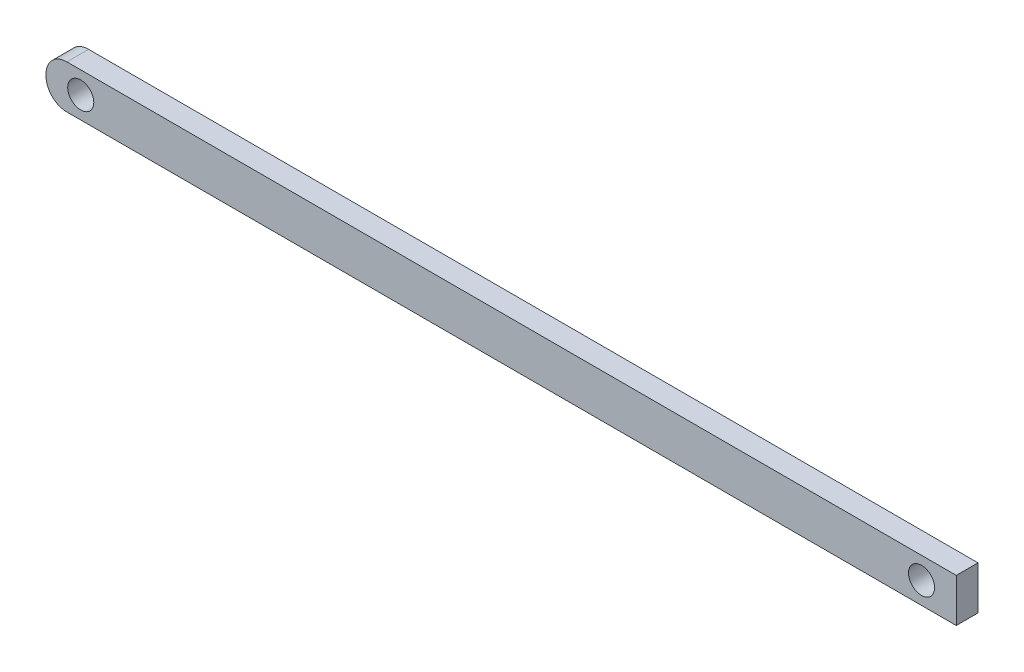
from build123d import *

# Parameters (mm, degrees)
SKETCH1_R               = 7.5
BOSS_EXTRUDE2_DEPTH     = 25
CUT_EXTRUDE1_DEPTH      = 525.744938041
CUT_EXTRUDE1_DEPTH_BACK = 525.744938041
SKETCH2_W               = 12.5
SKETCH2_H               = 25


with BuildPart() as part:
    # Sketch1 → Boss-Extrude2 (new body)
    with BuildSketch(Plane.XY):
        with BuildLine():
            Line((-250, 12.5), (262, 12.5))
            Line((262, 12.5), (262, -12.5))
            Line((262, -12.5), (-250, -12.5))
            ThreePointArc((-250, -12.5), (-258.485281374, -8.985281374), (-262, -0.5))
            Line((-262, -0.5), (-262, 0.5))
            ThreePointArc((-262, 0.5), (-258.485281374, 8.985281374), (-250, 12.5))
        make_face()
        with Locations((-242, 0)):
            Circle(SKETCH1_R, mode=Mode.SUBTRACT)
        with Locations((242, 0)):
            Circle(SKETCH1_R, mode=Mode.SUBTRACT)
    extrude(amount=BOSS_EXTRUDE2_DEPTH)

    # Sketch2 → Cut-Extrude1 (cut, two sides: drawn at the far end of the back side and taken through both)
    with BuildSketch(Plane(origin=(262, 0, 0), x_dir=(0, 0, -1), z_dir=(1, 0, 0)).offset(-CUT_EXTRUDE1_DEPTH_BACK)):
        with Locations((-6.25, 0)):
            Rectangle(SKETCH2_W, SKETCH2_H)
    extrude(amount=CUT_EXTRUDE1_DEPTH + CUT_EXTRUDE1_DEPTH_BACK, mode=Mode.SUBTRACT)


solid = part.part
